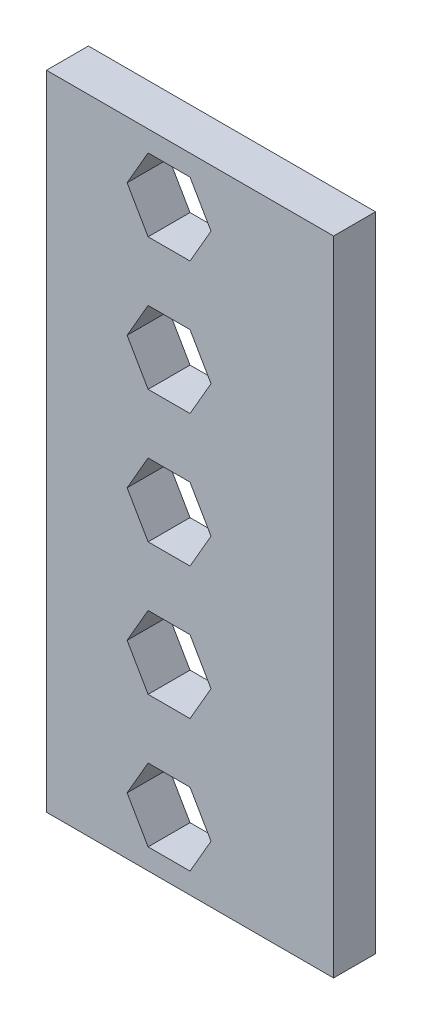
from build123d import *

# Parameters (mm, degrees)
SKETCH1_W               = 31.2625
SKETCH1_H               = 55
BOSS_EXTRUDE1_DEPTH     = 3.175
SKETCH2_R               = 1.5
CUT_EXTRUDE1_DEPTH      = 10
LPATTERN1_COUNT         = 3
LPATTERN1_PITCH         = 10
LPATTERN1_COL_COUNT     = 3
LPATTERN1_COL_PITCH     = 10
SKETCH3_W               = 6.35
SKETCH3_H               = 3.175
CUT_EXTRUDE2_DEPTH      = 10
LPATTERN2_COUNT         = 5
LPATTERN2_PITCH         = 6.35
LPATTERN2_COL_COUNT     = 5
LPATTERN2_COL_PITCH     = 6.35
SKETCH4_W               = 3.175
SKETCH4_H               = 3.6875
SKETCH4_H_2             = 3.175
CUT_EXTRUDE3_DEPTH      = 10
SKETCH5_W               = 6.35
SKETCH5_H               = 55
CUT_EXTRUDE4_DEPTH      = 10
SKETCH6_W               = 3.175
SKETCH6_H               = 3.175
CUT_EXTRUDE5_DEPTH      = 10
LPATTERN3_COUNT         = 2
LPATTERN3_PITCH         = 6.35
LPATTERN3_COUNT_DIR2    = 2
LPATTERN3_PITCH_DIR2    = 6.35
SKETCH7_W               = 5.8625
SKETCH7_H               = 3.175
CUT_EXTRUDE6_DEPTH      = 10
MIRROR1_COPY_1_SKETCH_W = 3.175
MIRROR1_COPY_1_SKETCH_H = 3.175
MIRROR1_COPY_1_DEPTH    = 10
MIRROR1_COPY_2_SKETCH_W = 3.175
MIRROR1_COPY_2_SKETCH_H = 3.175
MIRROR1_COPY_2_DEPTH    = 10
MIRROR1_COPY_3_SKETCH_W = 3.175
MIRROR1_COPY_3_SKETCH_H = 3.175
MIRROR1_COPY_3_DEPTH    = 10
SKETCH8_W               = 21.7375
SKETCH8_H               = 3.175
SKETCH8_W_2             = 3.175
SKETCH8_H_2             = 41.275
SKETCH8_W_3             = 15.875
CUT_EXTRUDE7_DEPTH      = 10
CUT_EXTRUDE8_DEPTH      = 10
LPATTERN4_COUNT         = 5
LPATTERN4_PITCH         = 10


with BuildPart() as part:
    # Sketch1 → Boss-Extrude1 (new body)
    with BuildSketch(Plane.XY):
        Rectangle(SKETCH1_W, SKETCH1_H)
    extrude(amount=BOSS_EXTRUDE1_DEPTH)

    # Sketch2 → Cut-Extrude1 (cut)
    with BuildSketch(Plane.XY.offset(3.175)):
        Circle(SKETCH2_R)
    cut_extrude1 = extrude(amount=-CUT_EXTRUDE1_DEPTH, mode=Mode.SUBTRACT)

    # LPattern1: Cut-Extrude1 ×3
    with Locations(*[(0, i * LPATTERN1_PITCH, 0) for i in range(1, LPATTERN1_COUNT)]):
        add(cut_extrude1, mode=Mode.SUBTRACT)

    # LPattern1 col: Cut-Extrude1 ×3
    with Locations(*[(0, -i * LPATTERN1_COL_PITCH, 0) for i in range(1, LPATTERN1_COL_COUNT)]):
        add(cut_extrude1, mode=Mode.SUBTRACT)

    # Sketch3 → Cut-Extrude2 (cut)
    with BuildSketch(Plane.XY.offset(3.175)):
        with Locations((15.63125, -3.175)):
            Rectangle(SKETCH3_W, SKETCH3_H)
    cut_extrude2 = extrude(amount=-CUT_EXTRUDE2_DEPTH, mode=Mode.SUBTRACT)

    # LPattern2: Cut-Extrude2 ×5
    with Locations(*[(0, i * LPATTERN2_PITCH, 0) for i in range(1, LPATTERN2_COUNT)]):
        add(cut_extrude2, mode=Mode.SUBTRACT)

    # LPattern2 col: Cut-Extrude2 ×5
    with Locations(*[(0, -i * LPATTERN2_COL_PITCH, 0) for i in range(1, LPATTERN2_COL_COUNT)]):
        add(cut_extrude2, mode=Mode.SUBTRACT)

    # Sketch4 → Cut-Extrude3 (cut)
    with BuildSketch(Plane.XY.offset(3.175)):
        with Locations((14.04375, 25.65625)):
            Rectangle(SKETCH4_W, SKETCH4_H)
        with Locations((14.04375, -25.4)):
            Rectangle(SKETCH4_W, SKETCH4_H_2)
    extrude(amount=-CUT_EXTRUDE3_DEPTH, mode=Mode.SUBTRACT)

    # Sketch5 → Cut-Extrude4 (cut)
    with BuildSketch(Plane.XY.offset(3.175)):
        with Locations((-12.45625, 0)):
            Rectangle(SKETCH5_W, SKETCH5_H)
    extrude(amount=-CUT_EXTRUDE4_DEPTH, mode=Mode.SUBTRACT)

    # Sketch6 → Cut-Extrude5 (cut)
    with BuildSketch(Plane.XY.offset(3.175)):
        with Locations((-4.51875, 25.9125)):
            Rectangle(SKETCH6_W, SKETCH6_H)
    cut_extrude5 = extrude(amount=-CUT_EXTRUDE5_DEPTH, mode=Mode.SUBTRACT)

    # LPattern3: Cut-Extrude5 2 × 2
    with Locations(*[(i * LPATTERN3_PITCH, j * LPATTERN3_PITCH_DIR2, 0) for i in range(LPATTERN3_COUNT) for j in range(LPATTERN3_COUNT_DIR2) if (i, j) != (0, 0)]):
        add(cut_extrude5, mode=Mode.SUBTRACT)

    # Sketch7 → Cut-Extrude6 (cut)
    with BuildSketch(Plane.XY.offset(3.175)):
        with Locations((9.525, 25.9125)):
            Rectangle(SKETCH7_W, SKETCH7_H)
    cut_extrude6 = extrude(amount=-CUT_EXTRUDE6_DEPTH, mode=Mode.SUBTRACT)

    # Mirror1: Cut-Extrude5, Cut-Extrude6 across plane
    add(cut_extrude5.mirror(Plane.ZX), mode=Mode.SUBTRACT)
    add(cut_extrude6.mirror(Plane.ZX), mode=Mode.SUBTRACT)

    # Mirror1 copy 1 sketch → Mirror1 copy 1 (cut)
    with BuildSketch(Plane(origin=(0, -6.35, 3.175), x_dir=(1, 0, 0), z_dir=(0, 0, 1))):
        with Locations((-4.51875, -25.9125)):
            Rectangle(MIRROR1_COPY_1_SKETCH_W, MIRROR1_COPY_1_SKETCH_H)
    extrude(amount=-MIRROR1_COPY_1_DEPTH, mode=Mode.SUBTRACT)

    # Mirror1 copy 2 sketch → Mirror1 copy 2 (cut)
    with BuildSketch(Plane(origin=(6.35, 0, 3.175), x_dir=(1, 0, 0), z_dir=(0, 0, 1))):
        with Locations((-4.51875, -25.9125)):
            Rectangle(MIRROR1_COPY_2_SKETCH_W, MIRROR1_COPY_2_SKETCH_H)
    extrude(amount=-MIRROR1_COPY_2_DEPTH, mode=Mode.SUBTRACT)

    # Mirror1 copy 3 sketch → Mirror1 copy 3 (cut)
    with BuildSketch(Plane(origin=(6.35, -6.35, 3.175), x_dir=(1, 0, 0), z_dir=(0, 0, 1))):
        with Locations((-4.51875, -25.9125)):
            Rectangle(MIRROR1_COPY_3_SKETCH_W, MIRROR1_COPY_3_SKETCH_H)
    extrude(amount=-MIRROR1_COPY_3_DEPTH, mode=Mode.SUBTRACT)

    # Sketch8 → Cut-Extrude7 (cut)
    with BuildSketch(Plane.XY.offset(3.175)):
        with Locations((1.5875, 25.9125)):
            Rectangle(SKETCH8_W, SKETCH8_H)
        with Locations((14.04375, 0)):
            Rectangle(SKETCH8_W_2, SKETCH8_H_2)
        with Locations((-1.34375, -25.9125)):
            Rectangle(SKETCH8_W_3, SKETCH8_H)
    extrude(amount=-CUT_EXTRUDE7_DEPTH, mode=Mode.SUBTRACT)

    # Sketch9 → Cut-Extrude8 (cut)
    with BuildSketch(Plane.XY.offset(3.175)):
        Polygon((3.175426481, 20), (1.58771324, 22.75), (-1.58771324, 22.75), (-3.175426481, 20), (-1.58771324, 17.25), (1.58771324, 17.25), align=None)
    cut_extrude8 = extrude(amount=-CUT_EXTRUDE8_DEPTH, mode=Mode.SUBTRACT)

    # LPattern4: Cut-Extrude8 ×5
    with Locations(*[(0, -i * LPATTERN4_PITCH, 0) for i in range(1, LPATTERN4_COUNT)]):
        add(cut_extrude8, mode=Mode.SUBTRACT)


solid = part.part
